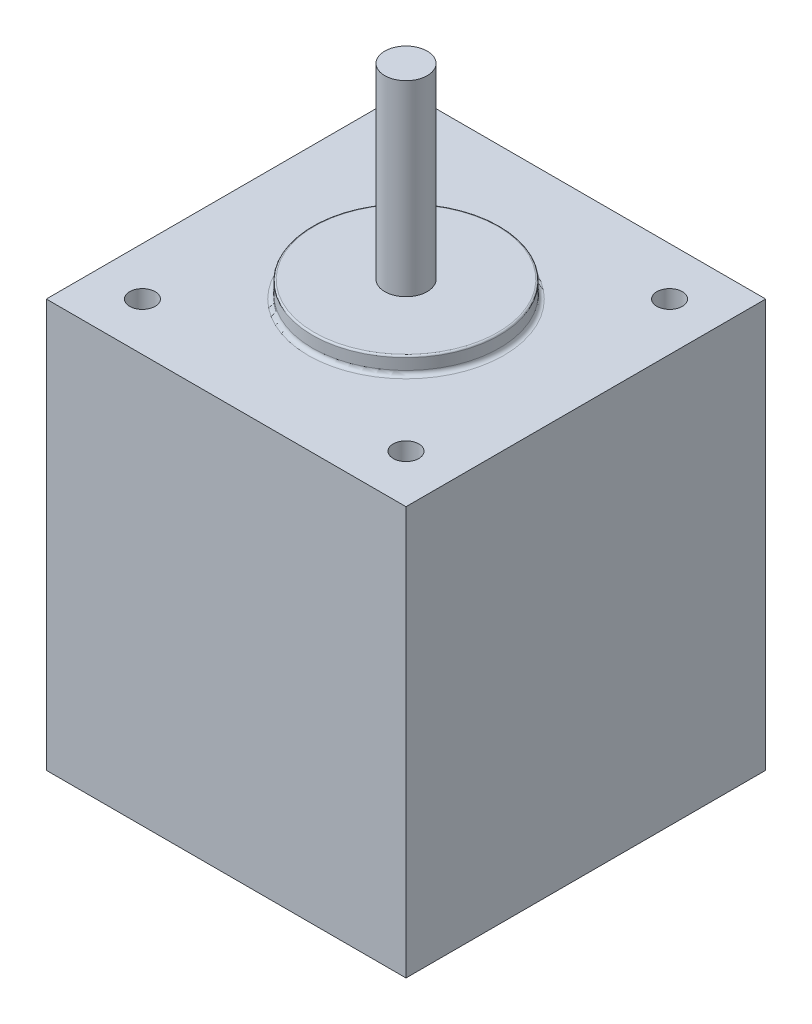
from build123d import *

# Parameters (mm, degrees)
SKETCH1_W           = 42.3
SKETCH1_H           = 42.3
SKETCH1_R           = 1.5
BOSS_EXTRUDE1_DEPTH = 48
SKETCH2_R           = 11
BOSS_EXTRUDE2_DEPTH = 2
SKETCH3_R           = 2.5
BOSS_EXTRUDE3_DEPTH = 24
FILLET1_R           = 0.5
FILLET2_R           = 0.2


with BuildPart() as part:
    # Sketch1 → Boss-Extrude1 (new body)
    with BuildSketch(Plane(origin=(0, 0, 0), x_dir=(1, 0, 0), z_dir=(0, 1, 0))):
        Rectangle(SKETCH1_W, SKETCH1_H)
        with Locations(Location((15.5, 15.5, 0), (0, 0, 270))):
            Circle(SKETCH1_R, mode=Mode.SUBTRACT)
        with Locations(Location((-15.5, 15.5, 0), (0, 0, 270))):
            Circle(SKETCH1_R, mode=Mode.SUBTRACT)
        with Locations(Location((-15.5, -15.5, 0), (0, 0, 270))):
            Circle(SKETCH1_R, mode=Mode.SUBTRACT)
        with Locations(Location((15.5, -15.5, 0), (0, 0, 270))):
            Circle(SKETCH1_R, mode=Mode.SUBTRACT)
    extrude(amount=-BOSS_EXTRUDE1_DEPTH)

    # Sketch2 → Boss-Extrude2 (add)
    with BuildSketch(Plane(origin=(0, 0, 0), x_dir=(1, 0, 0), z_dir=(0, 1, 0))):
        with Locations(Location((0, 0, 0), (0, 0, 270))):
            Circle(SKETCH2_R)
    extrude(amount=BOSS_EXTRUDE2_DEPTH)

    # Sketch3 → Boss-Extrude3 (add)
    with BuildSketch(Plane(origin=(0, 0, 0), x_dir=(1, 0, 0), z_dir=(0, 1, 0))):
        with Locations(Location((0, 0, 0), (0, 0, 270))):
            Circle(SKETCH3_R)
    extrude(amount=BOSS_EXTRUDE3_DEPTH)

    # Fillet1
    fillet1_edges = [part.edges().sort_by_distance(p)[0] for p in [
        (0, 0, -11),
    ]]
    fillet(fillet1_edges, radius=FILLET1_R)

    # Fillet2
    fillet2_edges = [part.edges().sort_by_distance(p)[0] for p in [
        (0, 2, -11),
    ]]
    fillet(fillet2_edges, radius=FILLET2_R)


solid = part.part
